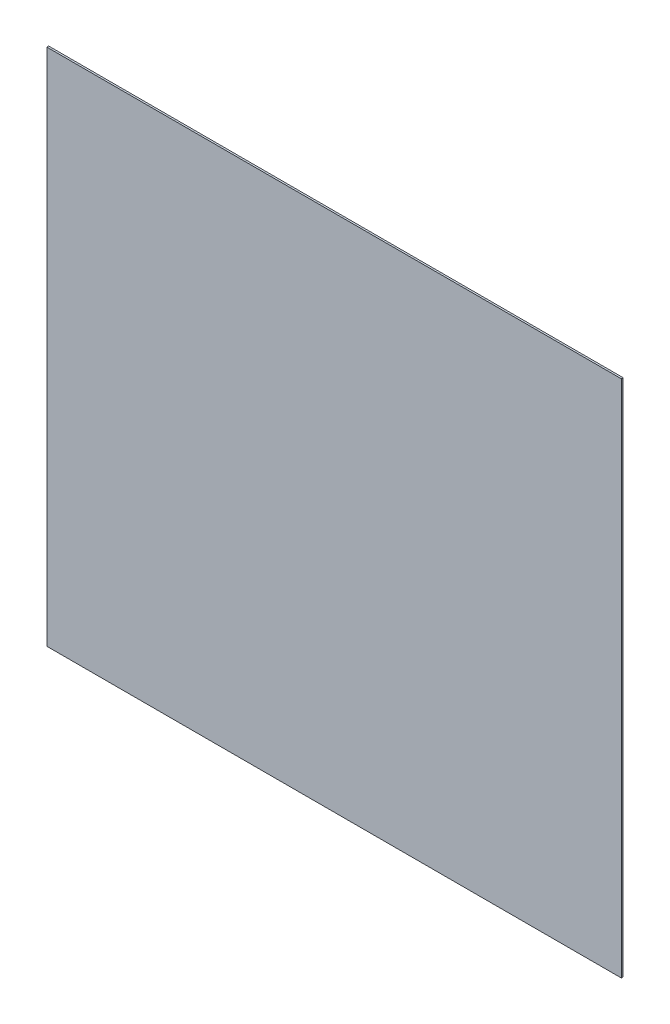
from build123d import *

# Parameters (mm, degrees)
SKETCH1_W           = 787.4
SKETCH1_H           = 711.2
BOSS_EXTRUDE1_DEPTH = 2.54


with BuildPart() as part:
    # Sketch1 → Boss-Extrude1 (new body)
    with BuildSketch(Plane.XY):
        with Locations((393.7, 355.6)):
            Rectangle(SKETCH1_W, SKETCH1_H)
    extrude(amount=BOSS_EXTRUDE1_DEPTH)


solid = part.part
